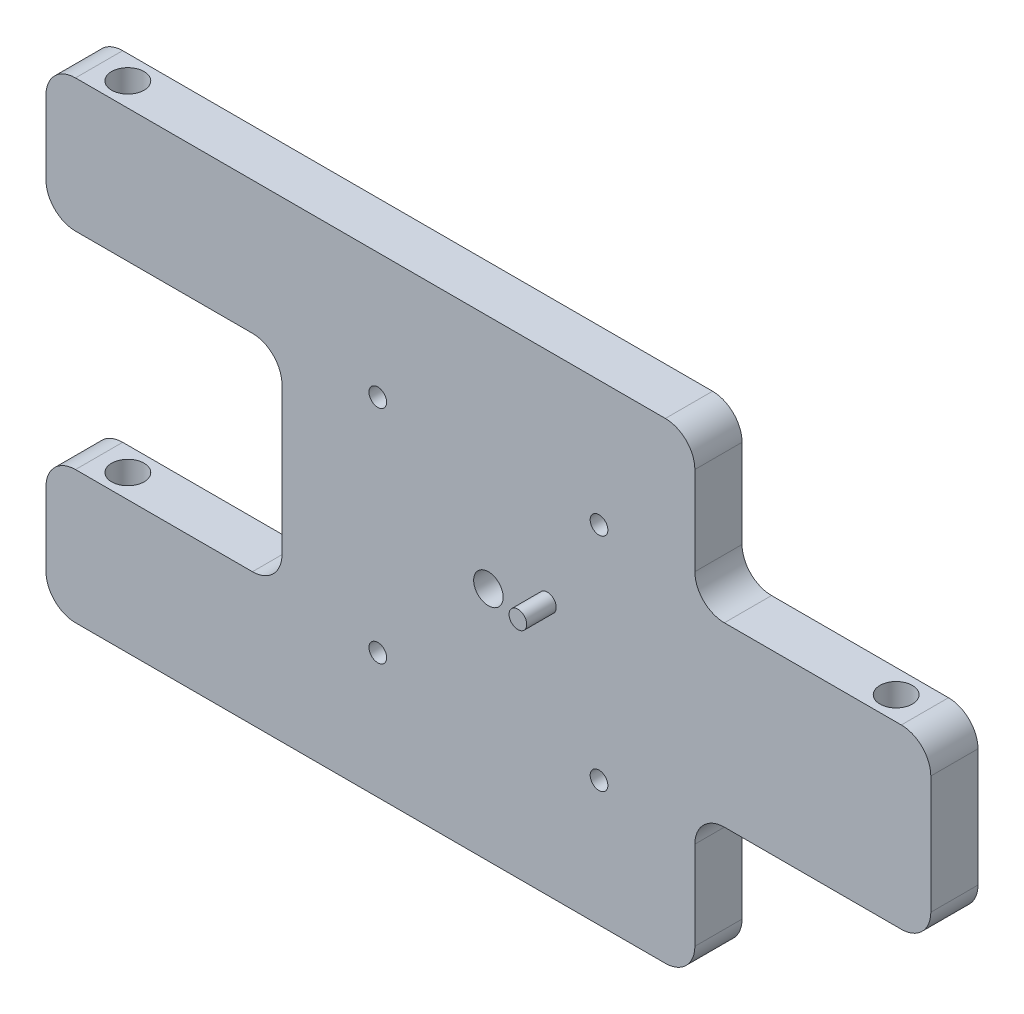
from build123d import *

# Parameters (mm, degrees)
SKETCH1_W           = 150
SKETCH1_H           = 8
SKETCH1_R           = 2.75
BOSS_EXTRUDE1_DEPTH = 40
SKETCH2_R           = 1.5
CUT_EXTRUDE1_DEPTH  = 86.375640554
SKETCH3_W           = 40
SKETCH3_H           = 35
SKETCH3_H_2         = 25
CUT_EXTRUDE2_DEPTH  = 86.375640554
FILLET1_R           = 5
SKETCH4_R           = 2.5
CUT_EXTRUDE3_DEPTH  = 86.375640554
SKETCH5_R           = 1.5
BOSS_EXTRUDE2_DEPTH = 5


with BuildPart() as part:
    # Sketch1 → Boss-Extrude1 (new, symmetric)
    with BuildSketch(Plane(origin=(0, 0, 0), x_dir=(1, 0, 0), z_dir=(0, 1, 0))):
        Rectangle(SKETCH1_W, SKETCH1_H)
        with Locations(Location((-65.125, 0, 0), (0, 0, 270))):
            Circle(SKETCH1_R, mode=Mode.SUBTRACT)
        with Locations(Location((65.125, 0, 0), (0, 0, 270))):
            Circle(SKETCH1_R, mode=Mode.SUBTRACT)
    extrude(amount=BOSS_EXTRUDE1_DEPTH, both=True)

    # Sketch2 → Cut-Extrude1 (cut, through all)
    with BuildSketch(Plane.XY.offset(4)):
        with Locations((-18.75, 18.75)):
            Circle(SKETCH2_R)
        with Locations((18.75, 18.75)):
            Circle(SKETCH2_R)
        with Locations((18.75, -18.75)):
            Circle(SKETCH2_R)
        with Locations((-18.75, -18.75)):
            Circle(SKETCH2_R)
    extrude(amount=-CUT_EXTRUDE1_DEPTH, mode=Mode.SUBTRACT)

    # Sketch3 → Cut-Extrude2 (cut, through all)
    with BuildSketch(Plane.XY.offset(4)):
        with Locations((-55, 0)):
            Rectangle(SKETCH3_W, SKETCH3_H)
        with Locations((55, 27.5)):
            Rectangle(SKETCH3_W, SKETCH3_H_2)
        with Locations((55, -27.5)):
            Rectangle(SKETCH3_W, SKETCH3_H_2)
    extrude(amount=-CUT_EXTRUDE2_DEPTH, mode=Mode.SUBTRACT)

    # Fillet1
    fillet1_edges = [part.edges().sort_by_distance(p)[0] for p in [
        (-75, 40, 0),
        (-75, -17.5, 0),
        (-75, 17.5, 0),
        (-35, 17.5, 0),
        (-35, -17.5, 0),
        (-75, -40, 0),
        (75, 15, 0),
        (35, 15, 0),
        (35, 40, 0),
        (35, -15, 0),
        (75, -15, 0),
        (35, -40, 0),
    ]]
    fillet(fillet1_edges, radius=FILLET1_R)

    # Sketch4 → Cut-Extrude3 (cut, through all)
    with BuildSketch(Plane.XY.offset(4)):
        Circle(SKETCH4_R)
    extrude(amount=-CUT_EXTRUDE3_DEPTH, mode=Mode.SUBTRACT)

    # Sketch5 → Boss-Extrude2 (add)
    with BuildSketch(Plane.XY.offset(4)):
        with Locations(Location((10, 3, 0), (0, 0, 180))):
            Circle(SKETCH5_R)
    extrude(amount=BOSS_EXTRUDE2_DEPTH)


solid = part.part
